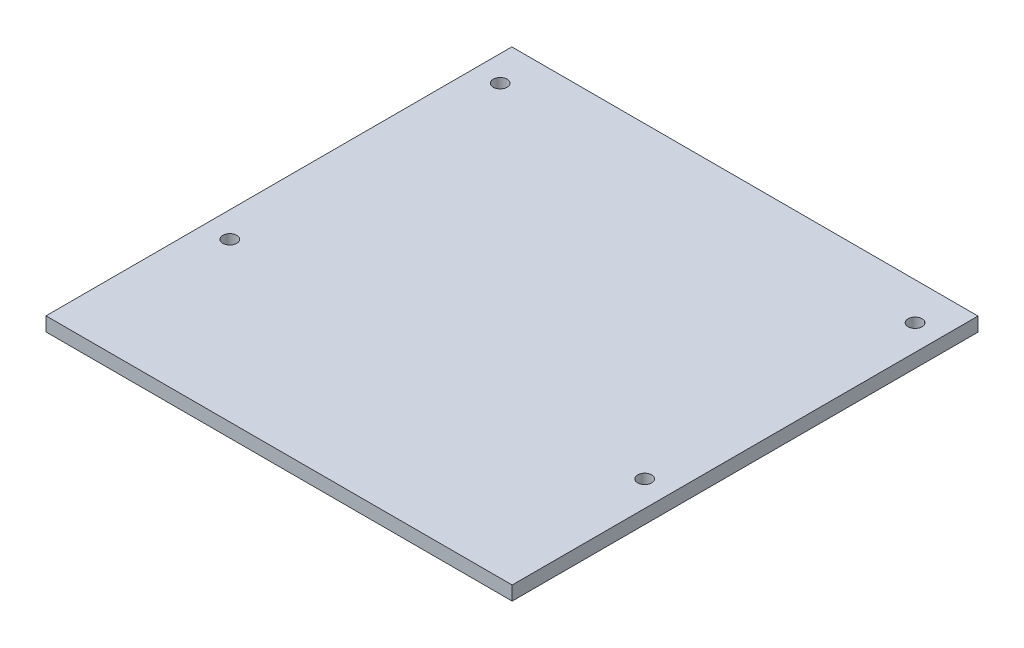
from build123d import *

# Parameters (mm, degrees)
SKETCH1_W           = 96.5
SKETCH1_H           = 0.9
BOSS_EXTRUDE1_DEPTH = 3
SKETCH2_W           = 100
SKETCH2_H           = 3
BOSS_EXTRUDE2_DEPTH = 91
SKETCH4_R           = 1.5
CUT_EXTRUDE1_DEPTH  = 108.806741442


with BuildPart() as part:
    # Sketch1 → Boss-Extrude1 (new body)
    with BuildSketch(Plane(origin=(0, 0, 0), x_dir=(1, 0, 0), z_dir=(0, 1, 0))):
        Polygon((-48.25, 0), (-50, 0), (-50, -4.463571588), (50, -4.463571588), (50, 0), (48.25, 0), (48.25, -0.9), (-48.25, -0.9), align=None)
        Polygon((-50, 4.463571588), (-50, 0), (-48.25, 0), (-48.25, 0.9), (48.25, 0.9), (48.25, 0), (50, 0), (50, 4.463571588), align=None)
        with Locations((0, -0.45)):
            Rectangle(SKETCH1_W, SKETCH1_H)
        with Locations((0, 0.45)):
            Rectangle(SKETCH1_W, SKETCH1_H)
    extrude(amount=BOSS_EXTRUDE1_DEPTH)

    # Sketch2 → Boss-Extrude2 (add)
    with BuildSketch(Plane(origin=(0, 0, -4.463571588), x_dir=(-1, 0, 0), z_dir=(0, 0, -1))):
        with Locations((0, 1.5)):
            Rectangle(SKETCH2_W, SKETCH2_H)
    extrude(amount=BOSS_EXTRUDE2_DEPTH)

    # Sketch4 → Cut-Extrude1 (cut, through all)
    with BuildSketch(Plane(origin=(0, 3, 0), x_dir=(1, 0, 0), z_dir=(0, 1, 0))):
        with Locations(Location((-44.5, 87.463571588, 0), (0, 0, 270))):
            Circle(SKETCH4_R)
        with Locations(Location((44.5, 87.463571588, 0), (0, 0, 270))):
            Circle(SKETCH4_R)
        with Locations(Location((-44.5, 29.463571588, 0), (0, 0, 270))):
            Circle(SKETCH4_R)
        with Locations(Location((44.5, 29.463571588, 0), (0, 0, 270))):
            Circle(SKETCH4_R)
    extrude(amount=-CUT_EXTRUDE1_DEPTH, mode=Mode.SUBTRACT)


solid = part.part
